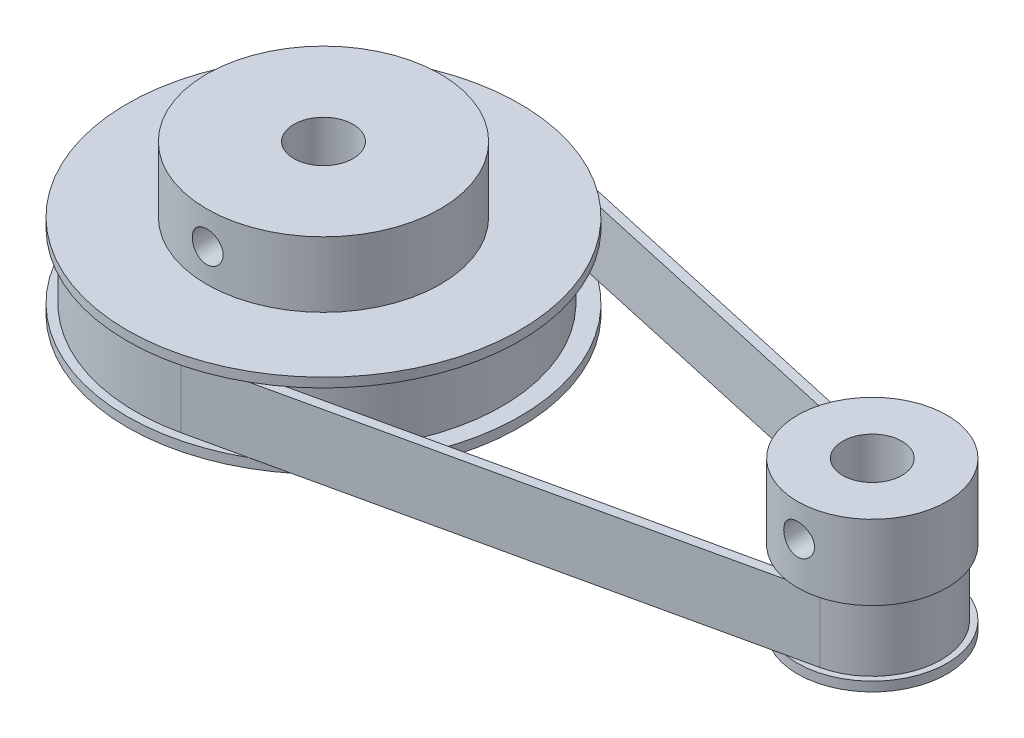
from build123d import *

# Parameters (mm, degrees)
SKETCH1_R                  = 19.1
BOSS_EXTRUDE1_DEPTH        = 3.5
SKETCH1_R_2                = 6.365
BOSS_EXTRUDE1_2_DEPTH      = 3.5
SKETCH3_R                  = 21
SKETCH3_R_2                = 8
BOSS_EXTRUDE2_DEPTH        = 1
SKETCH4_R                  = 12.5
SKETCH4_R_2                = 8
BOSS_EXTRUDE3_DEPTH        = 7
SKETCH5_R                  = 3.175
CUT_EXTRUDE1_DEPTH         = 84.987337736
M4X0_7_TAPPED_HOLE1_REACH  = 89.243
M4X0_7_TAPPED_HOLE1_BORE_R = 1.65
M4X0_7_TAPPED_HOLE2_REACH  = 87.616
M4X0_7_TAPPED_HOLE2_BORE_R = 1.65
EXTRUDE_THIN1_DEPTH        = 3.5


with BuildPart() as part:
    # Sketch1 → Boss-Extrude1 (new body)
    with BuildSketch(Plane(origin=(0, 0, 0), x_dir=(1, 0, 0), z_dir=(0, 1, 0))):
        with Locations(Location((-58.73, 0, 0), (0, 0, 270))):
            Circle(SKETCH1_R)
    extrude(amount=BOSS_EXTRUDE1_DEPTH)



with BuildPart() as body_2:
    # Sketch1 → Boss-Extrude1 2 (new body)
    with BuildSketch(Plane(origin=(0, 0, 0), x_dir=(1, 0, 0), z_dir=(0, 1, 0))):
        with Locations(Location((0, 0, 0), (0, 0, 270))):
            Circle(SKETCH1_R_2)
    extrude(amount=BOSS_EXTRUDE1_2_DEPTH)


with BuildPart() as part_1:
    add(part.part)

    add(body_2.part)  # Boss-Extrude2 merges body 2
    # Sketch3 → Boss-Extrude2 (add)
    with BuildSketch(Plane(origin=(0, 3.5, 0), x_dir=(1, 0, 0), z_dir=(0, 1, 0))):
        with Locations(Location((-58.73, 0, 0), (0, 0, 270))):
            Circle(SKETCH3_R)
        with Locations(Location((0, 0, 0), (0, 0, 270))):
            Circle(SKETCH3_R_2)
    extrude(amount=BOSS_EXTRUDE2_DEPTH)

    # Mirror1: part across plane


with BuildPart() as part_2:
    add(part_1.part)
    add(part_1.part.mirror(Plane.ZX))

    # Sketch4 → Boss-Extrude3 (add)
    with BuildSketch(Plane(origin=(0, 4.5, 0), x_dir=(1, 0, 0), z_dir=(0, 1, 0))):
        with Locations(Location((-58.73, 0, 0), (0, 0, 270))):
            Circle(SKETCH4_R)
        with Locations(Location((0, 0, 0), (0, 0, 270))):
            Circle(SKETCH4_R_2)
    extrude(amount=BOSS_EXTRUDE3_DEPTH)

    # Sketch5 → Cut-Extrude1 (cut, through all)
    with BuildSketch(Plane(origin=(0, 11.5, 0), x_dir=(1, 0, 0), z_dir=(0, 1, 0))):
        with Locations(Location((0, 0, 0), (0, 0, 270))):
            Circle(SKETCH5_R)
        with Locations(Location((-58.73, 0, 0), (0, 0, 270))):
            Circle(SKETCH5_R)
    extrude(amount=-CUT_EXTRUDE1_DEPTH, mode=Mode.SUBTRACT)

    # M4x0.7 Tapped Hole1 bore → M4x0.7 Tapped Hole1 (cut, up to next)
    with BuildSketch(Plane.XY.offset(12.5), mode=Mode.PRIVATE) as m4x0_7_tapped_hole1_sk1:
        with Locations((-58.73, 8)):
            Circle(M4X0_7_TAPPED_HOLE1_BORE_R)
    m4x0_7_tapped_hole1_tool1 = extrude(m4x0_7_tapped_hole1_sk1.sketch, amount=-M4X0_7_TAPPED_HOLE1_REACH, mode=Mode.PRIVATE) & part_2.part
    add(m4x0_7_tapped_hole1_tool1.solids().sort_by_distance((-58.73, 8, 12.5))[0], mode=Mode.SUBTRACT)

    # M4x0.7 Tapped Hole2 bore → M4x0.7 Tapped Hole2 (cut, up to next)
    with BuildSketch(Plane.XY.offset(8), mode=Mode.PRIVATE) as m4x0_7_tapped_hole2_sk1:
        with Locations((0, 8)):
            Circle(M4X0_7_TAPPED_HOLE2_BORE_R)
    m4x0_7_tapped_hole2_tool1 = extrude(m4x0_7_tapped_hole2_sk1.sketch, amount=-M4X0_7_TAPPED_HOLE2_REACH, mode=Mode.PRIVATE) & part_2.part
    add(m4x0_7_tapped_hole2_tool1.solids().sort_by_distance((0, 8, 8))[0], mode=Mode.SUBTRACT)


with BuildPart() as body_2_2:
    # Sketch2 → Extrude-Thin1 (new, symmetric)
    with BuildSketch(Plane(origin=(0, 0, 0), x_dir=(1, 0, 0), z_dir=(0, 1, 0))):
        with BuildLine():
            Line((1.597024945, -7.189766083), (-54.371520518, -19.62176487))
            ThreePointArc((-54.371520518, -19.62176487), (-78.83, 0), (-54.371520518, 19.62176487))
            Line((-54.371520518, 19.62176487), (1.597024945, 7.189766083))
            ThreePointArc((1.597024945, 7.189766083), (7.365, 0), (1.597024945, -7.189766083))
        make_face()
        with BuildLine():
            Line((1.380185169, -6.213558875), (-54.588360293, -18.645557662))
            ThreePointArc((-54.588360293, -18.645557662), (-77.83, 0), (-54.588360293, 18.645557662))
            Line((-54.588360293, 18.645557662), (1.380185169, 6.213558875))
            ThreePointArc((1.380185169, 6.213558875), (6.365, 0), (1.380185169, -6.213558875))
        make_face(mode=Mode.SUBTRACT)
    extrude(amount=EXTRUDE_THIN1_DEPTH, both=True)


solid = Compound([part_2.part, body_2_2.part])
